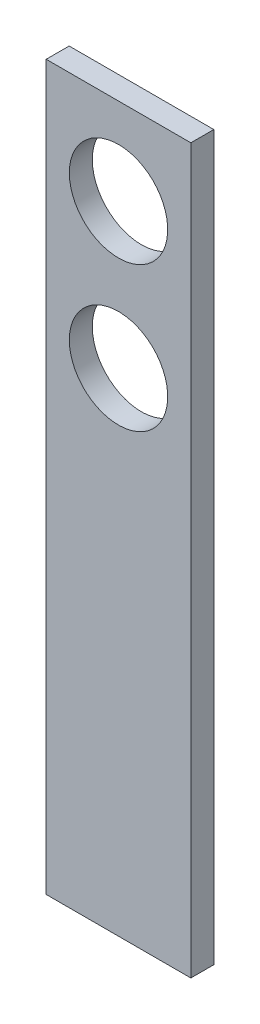
from build123d import *

# Parameters (mm, degrees)
SKETCH1_W            = 5
SKETCH1_H            = 25
BOSS_EXTRUDE1_DEPTH  = 0.79375
M3_CLEARANCE_HOLE1_D = 3.4


with BuildPart() as part:
    # Sketch1 → Boss-Extrude1 (new body)
    with BuildSketch(Plane.XY):
        with Locations((0.590659341, -7.953296703)):
            Rectangle(SKETCH1_W, SKETCH1_H)
    extrude(amount=BOSS_EXTRUDE1_DEPTH)

    # M3 Clearance Hole1 (through all)
    with Locations(Plane(origin=(0, 0, 0), x_dir=(-1, 0, 0), z_dir=(0, 0, -1))):
        with Locations((-0.590659341, 1.546703297), (-0.590659341, -3.453296703)):
            Hole(M3_CLEARANCE_HOLE1_D / 2)


solid = part.part
